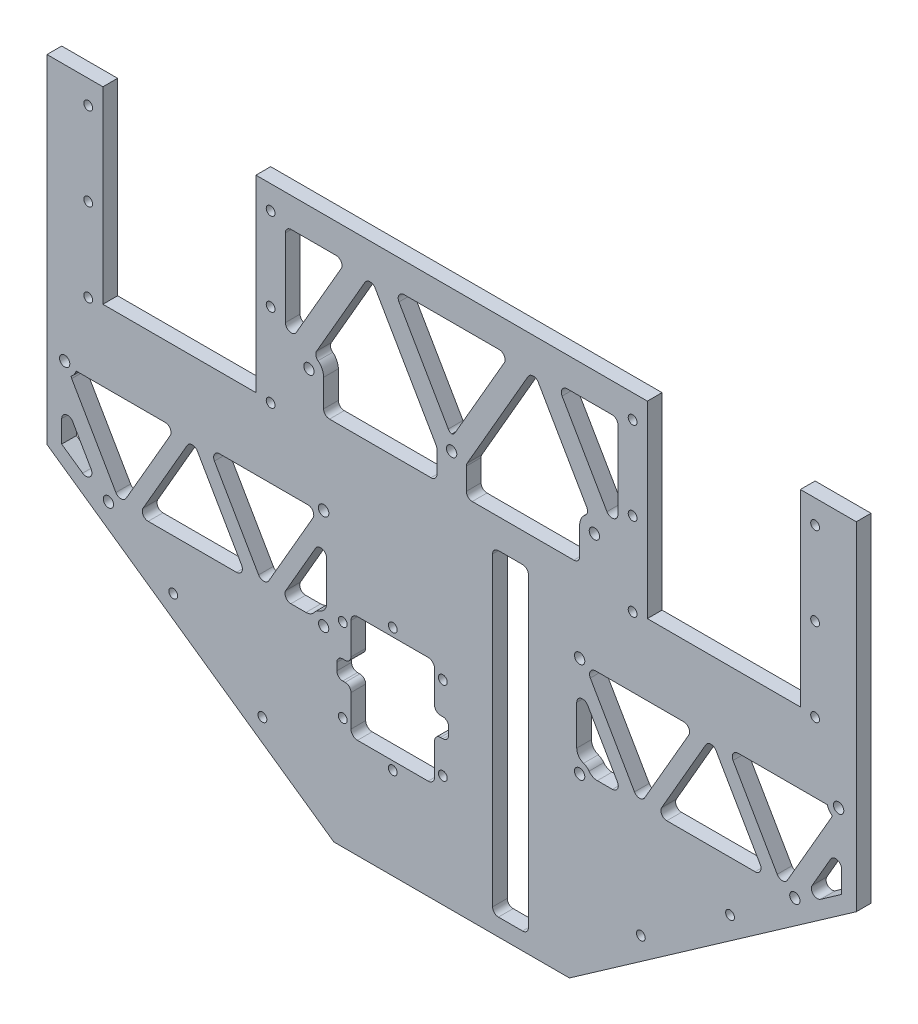
from build123d import *

# Parameters (mm, degrees)
MODEL_R             = 1.5
MODEL_R_2           = 1.75
MODEL_R_3           = 1.78
BOSS_EXTRUDE1_DEPTH = 5


with BuildPart() as part:
    # Model → Boss-Extrude1 (new body)
    with BuildSketch(Plane.XY):
        Polygon((-66.5, 67.5), (66.5, 67.5), (66.5, 3.5), (118.5, 3.5), (118.5, 67.5), (137.5, 67.5), (137.5, -47.265244493), (40.021777847, -115.5), (-40.021777847, -115.5), (-137.5, -47.265244493), (-137.5, 67.5), (-118.5, 67.5), (-118.5, 3.5), (-66.5, 3.5), align=None)
        with Locations((-64.291523492, -90.882080788)):
            Circle(MODEL_R, mode=Mode.SUBTRACT)
        with Locations((-94.603104551, -69.663974047)):
            Circle(MODEL_R, mode=Mode.SUBTRACT)
        with Locations((64.291523492, -90.882080788)):
            Circle(MODEL_R, mode=Mode.SUBTRACT)
        with Locations((94.603104551, -69.663974047)):
            Circle(MODEL_R, mode=Mode.SUBTRACT)
        with Locations((48.5, 19.5)):
            Circle(MODEL_R_2, mode=Mode.SUBTRACT)
        with Locations((0, 19.5)):
            Circle(MODEL_R_2, mode=Mode.SUBTRACT)
        with Locations((-48.5, 19.5)):
            Circle(MODEL_R_2, mode=Mode.SUBTRACT)
        with Locations((131.5, -19.680626826)):
            Circle(MODEL_R_2, mode=Mode.SUBTRACT)
        with Locations((-43.5, -53.680626826)):
            Circle(MODEL_R_2, mode=Mode.SUBTRACT)
        with Locations((-131.5, -19.680626826)):
            Circle(MODEL_R_2, mode=Mode.SUBTRACT)
        with Locations((-116.620882382, -53.680626826)):
            Circle(MODEL_R_2, mode=Mode.SUBTRACT)
        with Locations((116.620882382, -53.680626826)):
            Circle(MODEL_R_2, mode=Mode.SUBTRACT)
        with Locations((43.5, -19.680626826)):
            Circle(MODEL_R_2, mode=Mode.SUBTRACT)
        with Locations((43.5, -53.680626826)):
            Circle(MODEL_R_2, mode=Mode.SUBTRACT)
        with Locations((-43.5, -19.680626826)):
            Circle(MODEL_R_3, mode=Mode.SUBTRACT)
        with Locations((-20, -84.364)):
            Circle(MODEL_R, mode=Mode.SUBTRACT)
        with Locations((-3, -77.489)):
            Circle(MODEL_R, mode=Mode.SUBTRACT)
        with Locations((-3, -49.239)):
            Circle(MODEL_R, mode=Mode.SUBTRACT)
        with Locations((-20, -42.364)):
            Circle(MODEL_R, mode=Mode.SUBTRACT)
        with Locations((-37, -49.239)):
            Circle(MODEL_R, mode=Mode.SUBTRACT)
        with Locations((-37, -77.489)):
            Circle(MODEL_R, mode=Mode.SUBTRACT)
        with Locations((-61.5, 31.25)):
            Circle(MODEL_R, mode=Mode.SUBTRACT)
        with Locations((-61.5, 3)):
            Circle(MODEL_R, mode=Mode.SUBTRACT)
        with Locations((-123.5, 59.5)):
            Circle(MODEL_R, mode=Mode.SUBTRACT)
        with Locations((-123.5, 31.25)):
            Circle(MODEL_R, mode=Mode.SUBTRACT)
        with Locations((-123.5, 3)):
            Circle(MODEL_R, mode=Mode.SUBTRACT)
        with Locations((-61.5, 59.5)):
            Circle(MODEL_R, mode=Mode.SUBTRACT)
        with Locations((123.5, 31.25)):
            Circle(MODEL_R, mode=Mode.SUBTRACT)
        with Locations((123.5, 3)):
            Circle(MODEL_R, mode=Mode.SUBTRACT)
        with Locations((61.5, 59.5)):
            Circle(MODEL_R, mode=Mode.SUBTRACT)
        with Locations((61.5, 31.25)):
            Circle(MODEL_R, mode=Mode.SUBTRACT)
        with Locations((61.5, 3)):
            Circle(MODEL_R, mode=Mode.SUBTRACT)
        with Locations((123.5, 59.5)):
            Circle(MODEL_R, mode=Mode.SUBTRACT)
        with BuildLine():
            Line((25.980762114, 54.5), (5.267949192, 18.624355653))
            ThreePointArc((5.267949192, 18.624355653), (5.068148347, 18.141993743), (5, 17.624355653))
            Line((5, 17.624355653), (5, 10.210682988))
            ThreePointArc((5, 10.210682988), (5.585786438, 8.796469425), (7, 8.210682988))
            Line((7, 8.210682988), (41.5, 8.210682988))
            ThreePointArc((41.5, 8.210682988), (42.914213562, 8.796469425), (43.5, 10.210682988))
            Line((43.5, 10.210682988), (43.5, 19.5))
            ThreePointArc((43.5, 19.5), (44.00160767, 21.682765779), (45.405786579, 23.427574736))
            ThreePointArc((45.405786579, 23.427574736), (46.132123083, 24.620956537), (45.900152018, 25.99860463))
            Line((45.900152018, 25.99860463), (29.444863729, 54.5))
            ThreePointArc((29.444863729, 54.5), (27.712812921, 55.5), (25.980762114, 54.5))
        make_face(mode=Mode.SUBTRACT)
        with BuildLine():
            Line((-56.5, 55.5), (-56.5, 29.103230987))
            ThreePointArc((-56.5, 29.103230987), (-55.01763809, 27.171379335), (-52.767949192, 28.103230987))
            Line((-52.767949192, 28.103230987), (-37.527767497, 54.5))
            ThreePointArc((-37.527767497, 54.5), (-37.527767497, 56.5), (-39.259818305, 57.5))
            Line((-39.259818305, 57.5), (-54.5, 57.5))
            ThreePointArc((-54.5, 57.5), (-55.914213562, 56.914213562), (-56.5, 55.5))
        make_face(mode=Mode.SUBTRACT)
        with BuildLine():
            Line((-5, 10.210682988), (-5, 17.624355653))
            ThreePointArc((-5, 17.624355653), (-5.068148347, 18.141993743), (-5.267949192, 18.624355653))
            Line((-5.267949192, 18.624355653), (-25.980762114, 54.5))
            ThreePointArc((-25.980762114, 54.5), (-27.712812921, 55.5), (-29.444863729, 54.5))
            Line((-29.444863729, 54.5), (-45.900152018, 25.99860463))
            ThreePointArc((-45.900152018, 25.99860463), (-46.132123083, 24.620956537), (-45.405786579, 23.427574736))
            ThreePointArc((-45.405786579, 23.427574736), (-44.00160767, 21.682765779), (-43.5, 19.5))
            Line((-43.5, 19.5), (-43.5, 10.210682988))
            ThreePointArc((-43.5, 10.210682988), (-42.914213562, 8.796469425), (-41.5, 8.210682988))
            Line((-41.5, 8.210682988), (-7, 8.210682988))
            ThreePointArc((-7, 8.210682988), (-5.585786438, 8.796469425), (-5, 10.210682988))
        make_face(mode=Mode.SUBTRACT)
        with BuildLine():
            Line((47.118802154, -23.680626826), (62.129909152, -49.680626826))
            ThreePointArc((62.129909152, -49.680626826), (63.86195996, -50.680626826), (65.594010768, -49.680626826))
            Line((65.594010768, -49.680626826), (80.605117767, -23.680626826))
            ThreePointArc((80.605117767, -23.680626826), (80.605117767, -21.680626826), (78.873066959, -20.680626826))
            Line((78.873066959, -20.680626826), (48.850852961, -20.680626826))
            ThreePointArc((48.850852961, -20.680626826), (47.118802154, -21.680626826), (47.118802154, -23.680626826))
        make_face(mode=Mode.SUBTRACT)
        with BuildLine():
            Line((49.5, -52.680626826), (54.624355653, -52.680626826))
            ThreePointArc((54.624355653, -52.680626826), (56.356406461, -51.680626826), (56.356406461, -49.680626826))
            Line((56.356406461, -49.680626826), (46.232050808, -32.144728441))
            ThreePointArc((46.232050808, -32.144728441), (43.98236191, -31.212876788), (42.5, -33.144728441))
            Line((42.5, -33.144728441), (42.5, -46.609559014))
            ThreePointArc((42.5, -46.609559014), (43.142261967, -48.630284956), (44.833333333, -49.909390659))
            ThreePointArc((44.833333333, -49.909390659), (45.868089934, -50.456941036), (46.7, -51.280626826))
            ThreePointArc((46.7, -51.280626826), (47.934752416, -52.311121994), (49.5, -52.680626826))
        make_face(mode=Mode.SUBTRACT)
        with BuildLine():
            Line((104.853829072, -49.680626826), (89.842722074, -23.680626826))
            ThreePointArc((89.842722074, -23.680626826), (88.110671266, -22.680626826), (86.378620458, -23.680626826))
            Line((86.378620458, -23.680626826), (71.367513459, -49.680626826))
            ThreePointArc((71.367513459, -49.680626826), (71.367513459, -51.680626826), (73.099564267, -52.680626826))
            Line((73.099564267, -52.680626826), (103.121778265, -52.680626826))
            ThreePointArc((103.121778265, -52.680626826), (104.853829072, -51.680626826), (104.853829072, -49.680626826))
        make_face(mode=Mode.SUBTRACT)
        with BuildLine():
            Line((-71.367513459, -49.680626826), (-86.378620458, -23.680626826))
            ThreePointArc((-86.378620458, -23.680626826), (-88.110671266, -22.680626826), (-89.842722074, -23.680626826))
            Line((-89.842722074, -23.680626826), (-104.853829072, -49.680626826))
            ThreePointArc((-104.853829072, -49.680626826), (-104.853829072, -51.680626826), (-103.121778265, -52.680626826))
            Line((-103.121778265, -52.680626826), (-73.099564267, -52.680626826))
            ThreePointArc((-73.099564267, -52.680626826), (-71.367513459, -51.680626826), (-71.367513459, -49.680626826))
        make_face(mode=Mode.SUBTRACT)
        with BuildLine():
            Line((-110.627331764, -49.680626826), (-95.616224765, -23.680626826))
            ThreePointArc((-95.616224765, -23.680626826), (-95.616224765, -21.680626826), (-97.348275573, -20.680626826))
            Line((-97.348275573, -20.680626826), (-127.370489571, -20.680626826))
            ThreePointArc((-127.370489571, -20.680626826), (-127.501260859, -20.684906687), (-127.631472465, -20.697727955))
            ThreePointArc((-127.631472465, -20.697727955), (-128.263833291, -22.031631937), (-129.336955988, -23.045331954))
            ThreePointArc((-129.336955988, -23.045331954), (-129.24683104, -23.372972614), (-129.102540378, -23.680626826))
            Line((-129.102540378, -23.680626826), (-114.09143338, -49.680626826))
            ThreePointArc((-114.09143338, -49.680626826), (-112.359382572, -50.680626826), (-110.627331764, -49.680626826))
        make_face(mode=Mode.SUBTRACT)
        with BuildLine():
            Line((-42.5, -46.609559014), (-42.5, -33.144728441))
            ThreePointArc((-42.5, -33.144728441), (-43.98236191, -31.212876788), (-46.232050808, -32.144728441))
            Line((-46.232050808, -32.144728441), (-56.356406461, -49.680626826))
            ThreePointArc((-56.356406461, -49.680626826), (-56.356406461, -51.680626826), (-54.624355653, -52.680626826))
            Line((-54.624355653, -52.680626826), (-49.5, -52.680626826))
            ThreePointArc((-49.5, -52.680626826), (-47.934752416, -52.311121994), (-46.7, -51.280626826))
            ThreePointArc((-46.7, -51.280626826), (-45.868089934, -50.456941036), (-44.833333333, -49.909390659))
            ThreePointArc((-44.833333333, -49.909390659), (-43.142261967, -48.630284956), (-42.5, -46.609559014))
        make_face(mode=Mode.SUBTRACT)
        with BuildLine():
            Line((-62.129909152, -49.680626826), (-47.118802154, -23.680626826))
            ThreePointArc((-47.118802154, -23.680626826), (-47.118802154, -21.680626826), (-48.850852961, -20.680626826))
            Line((-48.850852961, -20.680626826), (-78.873066959, -20.680626826))
            ThreePointArc((-78.873066959, -20.680626826), (-80.605117767, -21.680626826), (-80.605117767, -23.680626826))
            Line((-80.605117767, -23.680626826), (-65.594010768, -49.680626826))
            ThreePointArc((-65.594010768, -49.680626826), (-63.86195996, -50.680626826), (-62.129909152, -49.680626826))
        make_face(mode=Mode.SUBTRACT)
        with BuildLine():
            Line((-122.502232584, -47.006657187), (-128.767949192, -36.154117676))
            ThreePointArc((-128.767949192, -36.154117676), (-131.01763809, -35.222266024), (-132.5, -37.154117676))
            Line((-132.5, -37.154117676), (-132.5, -44.661966685))
            Line((-132.5, -44.661966685), (-125.381208081, -49.645121028))
            ThreePointArc((-125.381208081, -49.645121028), (-122.883000297, -49.481117765), (-122.502232584, -47.006657187))
        make_face(mode=Mode.SUBTRACT)
        with BuildLine():
            Line((122.502232584, -47.006657187), (128.767949192, -36.154117676))
            ThreePointArc((128.767949192, -36.154117676), (131.01763809, -35.222266024), (132.5, -37.154117676))
            Line((132.5, -37.154117676), (132.5, -44.661966685))
            Line((132.5, -44.661966685), (125.381208081, -49.645121028))
            ThreePointArc((125.381208081, -49.645121028), (122.883000297, -49.481117765), (122.502232584, -47.006657187))
        make_face(mode=Mode.SUBTRACT)
        with BuildLine():
            Line((-3, -66.614), (-3.8, -66.614))
            ThreePointArc((-3.8, -66.614), (-5.214213562, -67.199786438), (-5.8, -68.614))
            Line((-5.8, -68.614), (-5.8, -79.364))
            ThreePointArc((-5.8, -79.364), (-6.444365081, -80.919634919), (-8, -81.564))
            Line((-8, -81.564), (-32, -81.564))
            ThreePointArc((-32, -81.564), (-33.555634919, -80.919634919), (-34.2, -79.364))
            Line((-34.2, -79.364), (-34.2, -68.614))
            ThreePointArc((-34.2, -68.614), (-34.785786438, -67.199786438), (-36.2, -66.614))
            Line((-36.2, -66.614), (-37, -66.614))
            ThreePointArc((-37, -66.614), (-38.414213562, -66.028213562), (-39, -64.614))
            Line((-39, -64.614), (-39, -62.114))
            ThreePointArc((-39, -62.114), (-38.414213562, -60.699786438), (-37, -60.114))
            Line((-37, -60.114), (-36.2, -60.114))
            ThreePointArc((-36.2, -60.114), (-34.785786438, -59.528213562), (-34.2, -58.114))
            Line((-34.2, -58.114), (-34.2, -47.364))
            ThreePointArc((-34.2, -47.364), (-33.555634919, -45.808365081), (-32, -45.164))
            Line((-32, -45.164), (-8, -45.164))
            ThreePointArc((-8, -45.164), (-6.444365081, -45.808365081), (-5.8, -47.364))
            Line((-5.8, -47.364), (-5.8, -58.114))
            ThreePointArc((-5.8, -58.114), (-5.214213562, -59.528213562), (-3.8, -60.114))
            Line((-3.8, -60.114), (-3, -60.114))
            ThreePointArc((-3, -60.114), (-1.585786438, -60.699786438), (-1, -62.114))
            Line((-1, -62.114), (-1, -64.614))
            ThreePointArc((-1, -64.614), (-1.585786438, -66.028213562), (-3, -66.614))
        make_face(mode=Mode.SUBTRACT)
        with BuildLine():
            Line((15.9, -109.632447797), (24.1, -109.632447797))
            ThreePointArc((24.1, -109.632447797), (25.514213562, -109.046661359), (26.1, -107.632447797))
            Line((26.1, -107.632447797), (26.1, -3.789317012))
            ThreePointArc((26.1, -3.789317012), (25.514213562, -2.37510345), (24.1, -1.789317012))
            Line((24.1, -1.789317012), (15.9, -1.789317012))
            ThreePointArc((15.9, -1.789317012), (14.485786438, -2.37510345), (13.9, -3.789317012))
            Line((13.9, -3.789317012), (13.9, -107.632447797))
            ThreePointArc((13.9, -107.632447797), (14.485786438, -109.046661359), (15.9, -109.632447797))
        make_face(mode=Mode.SUBTRACT)
        with BuildLine():
            Line((110.627331764, -49.680626826), (95.616224765, -23.680626826))
            ThreePointArc((95.616224765, -23.680626826), (95.616224765, -21.680626826), (97.348275573, -20.680626826))
            Line((97.348275573, -20.680626826), (127.370489571, -20.680626826))
            ThreePointArc((127.370489571, -20.680626826), (127.501260859, -20.684906687), (127.631472465, -20.697727955))
            ThreePointArc((127.631472465, -20.697727955), (128.263833291, -22.031631937), (129.336955988, -23.045331954))
            ThreePointArc((129.336955988, -23.045331954), (129.24683104, -23.372972614), (129.102540378, -23.680626826))
            Line((129.102540378, -23.680626826), (114.09143338, -49.680626826))
            ThreePointArc((114.09143338, -49.680626826), (112.359382572, -50.680626826), (110.627331764, -49.680626826))
        make_face(mode=Mode.SUBTRACT)
        with BuildLine():
            Line((56.5, 55.5), (56.5, 29.103230987))
            ThreePointArc((56.5, 29.103230987), (55.01763809, 27.171379335), (52.767949192, 28.103230987))
            Line((52.767949192, 28.103230987), (37.527767497, 54.5))
            ThreePointArc((37.527767497, 54.5), (37.527767497, 56.5), (39.259818305, 57.5))
            Line((39.259818305, 57.5), (54.5, 57.5))
            ThreePointArc((54.5, 57.5), (55.914213562, 56.914213562), (56.5, 55.5))
        make_face(mode=Mode.SUBTRACT)
        with BuildLine():
            Line((1.140230516, 25.474937186), (17.897858345, 54.5))
            ThreePointArc((17.897858345, 54.5), (17.897858345, 56.5), (16.165807537, 57.5))
            Line((16.165807537, 57.5), (-16.165807537, 57.5))
            ThreePointArc((-16.165807537, 57.5), (-17.897858345, 56.5), (-17.897858345, 54.5))
            Line((-17.897858345, 54.5), (-1.140230516, 25.474937186))
            ThreePointArc((-1.140230516, 25.474937186), (-0.656104236, 24.91202824), (0, 24.564505626))
            ThreePointArc((0, 24.564505626), (0.656104236, 24.91202824), (1.140230516, 25.474937186))
        make_face(mode=Mode.SUBTRACT)
    extrude(amount=BOSS_EXTRUDE1_DEPTH)


solid = part.part
